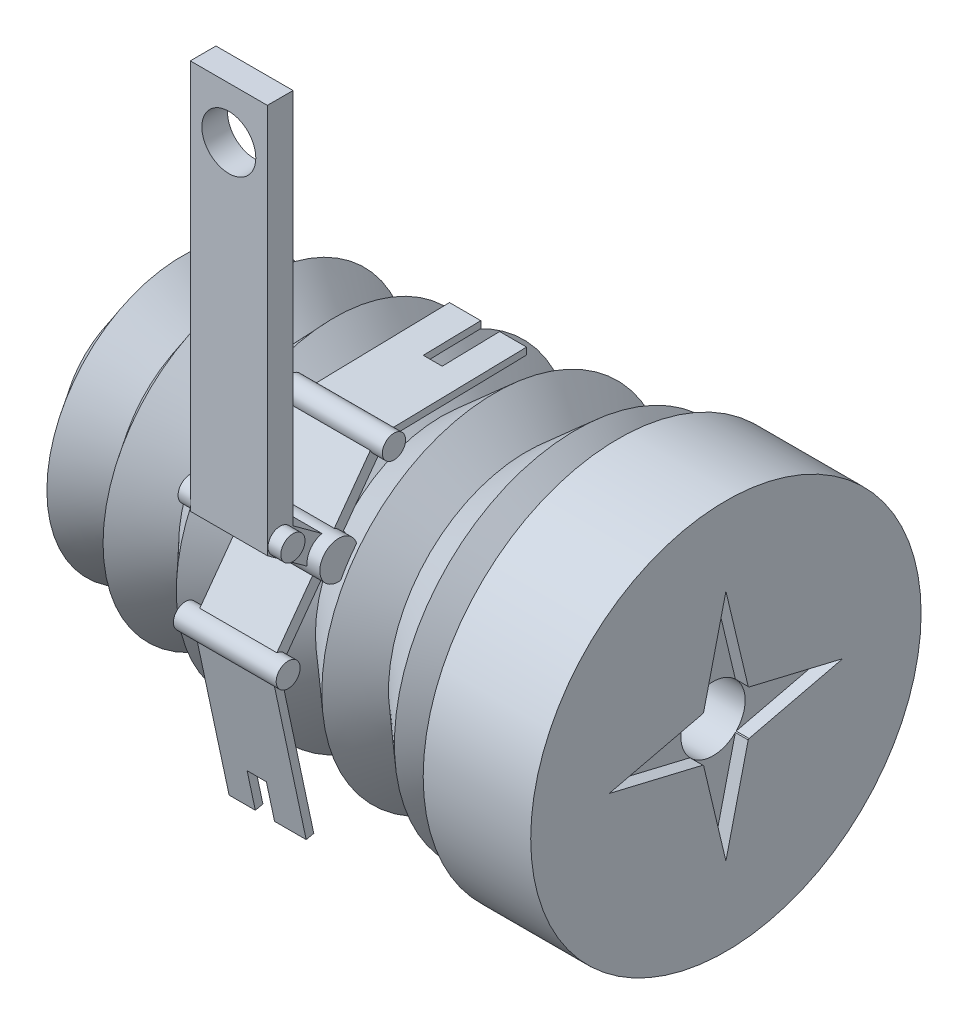
from build123d import *

# Parameters (mm, degrees)
SKIZZE3_R                             = 4.65
SCHNITT_LINEAR_AUSTRAGEN1_DEPTH       = 23
SKIZZE4_R                             = 2.5
SCHNITT_LINEAR_AUSTRAGEN2_DEPTH       = 32.476295332
AUFSATZ_LINEAR_AUSTRAGEN2_DEPTH       = 6
SKIZZE10_R                            = 2.1
SCHNITT_LINEAR_AUSTRAGEN4_DEPTH       = 6
SKIZZE13_W                            = 6
SKIZZE13_H                            = 0.905916259
AUFSATZ_LINEAR_AUSTRAGEN3_DEPTH       = 6
SKIZZE14_W                            = 6
SKIZZE14_H                            = 0.886770142
AUFSATZ_LINEAR_AUSTRAGEN4_DEPTH       = 6
AUFSATZ_LINEAR_AUSTRAGEN5_DEPTH       = 6
AUFSATZ_LINEAR_AUSTRAGEN6_DEPTH       = 6
SCHNITT_LINEAR_AUSTRAGEN5_DEPTH       = 1
KREISMUSTER1_COUNT                    = 4
AUFSATZ_LINEAR_AUSTRAGEN7_DEPTH       = 1
AUFSATZ_LINEAR_AUSTRAGEN7_DEPTH_BACK  = 7
SKIZZE24_R                            = 1.46260877
AUFSATZ_LINEAR_AUSTRAGEN8_DEPTH       = 1
AUFSATZ_LINEAR_AUSTRAGEN8_DEPTH_BACK  = 7
SKIZZE25_R                            = 0.941763398
AUFSATZ_LINEAR_AUSTRAGEN9_DEPTH       = 1
AUFSATZ_LINEAR_AUSTRAGEN9_DEPTH_BACK  = 7
SKIZZE26_R                            = 0.9041841
AUFSATZ_LINEAR_AUSTRAGEN10_DEPTH      = 1
AUFSATZ_LINEAR_AUSTRAGEN10_DEPTH_BACK = 7
SKIZZE27_R                            = 0.932524048
SKIZZE28_W                            = 1.499442475
SKIZZE28_H                            = 3.05198511
SCHNITT_LINEAR_AUSTRAGEN6_DEPTH       = 2
SKIZZE29_W                            = 1.472214026
SKIZZE29_H                            = 4.476539639
SCHNITT_LINEAR_AUSTRAGEN7_DEPTH       = 0.6


with BuildPart() as part:
    # Skizze2 → Rotation5 (revolve)
    with BuildSketch(Plane.XY, mode=Mode.PRIVATE) as rotation5_sk:
        Polygon((0, 0), (0, 6), (3.36648022, 10.528331662), (6.412062892, 8.264165831), (9.130397088, 11.920661045), (12.157026773, 9.06464462), (15.190566342, 12.27940236), (17.374944781, 9.800306185), (20.845408565, 12.858197338), (23.539774185, 9.800306185), (27.723555025, 13.486714461), (30.156102347, 10.725966298), (34.013267201, 14.124587063), (36.476289904, 11.329251761), (37.323543296, 15.194689333), (45.693256891, 15.194689333), (45.693256891, 0), (40, 0), align=None)
    revolve(rotation5_sk.sketch.rotate(Axis((45.693256891, 0, 0), (-1, 0, 0)), 90), axis=Axis((45.693256891, 0, 0), (-1, 0, 0)))

    # Skizze3 → Schnitt-Linear austragen1 (cut)
    with BuildSketch(Plane.ZY):
        Circle(SKIZZE3_R)
    extrude(amount=-SCHNITT_LINEAR_AUSTRAGEN1_DEPTH, mode=Mode.SUBTRACT)

    # Skizze4 → Schnitt-Linear austragen2 (cut, through all)
    with BuildSketch(Plane.ZY.offset(-23)):
        Circle(SKIZZE4_R)
    extrude(amount=-SCHNITT_LINEAR_AUSTRAGEN2_DEPTH, mode=Mode.SUBTRACT)

    # Skizze8 → Aufsatz-Linear austragen2 (add)
    with BuildSketch(Plane.ZY.offset(-20)):
        Polygon((5.135425827, 1.713216567), (16, 9.637964787), (16, 40), (14, 40), (14, 10.654654556), (3.956822965, 3.329043072), align=None)
    extrude(amount=-AUFSATZ_LINEAR_AUSTRAGEN2_DEPTH)

    # Skizze10 → Schnitt-Linear austragen4 (cut)
    with BuildSketch(Plane.XY.offset(16)):
        with Locations((23, 36)):
            Circle(SKIZZE10_R)
    extrude(amount=-SCHNITT_LINEAR_AUSTRAGEN4_DEPTH, mode=Mode.SUBTRACT)

    # Skizze13 → Aufsatz-Linear austragen3 (add)
    with BuildSketch(Plane(origin=(0, -1.326741748, 0.96774104), x_dir=(1, 0, 0), z_dir=(-4.115069899356744e-15, -0.8079132523298957, 0.5893014311112186))):
        with Locations((23, 13.484679747)):
            Rectangle(SKIZZE13_W, SKIZZE13_H)
    extrude(amount=AUFSATZ_LINEAR_AUSTRAGEN3_DEPTH)

    # Skizze14 → Aufsatz-Linear austragen4 (add)
    with BuildSketch(Plane(origin=(0, 0.289084756, -0.210861822), x_dir=(1, 0, 0), z_dir=(4.115069899356744e-15, 0.807913252329896, -0.5893014311112185))):
        with Locations((23, -13.507060971)):
            Rectangle(SKIZZE14_W, SKIZZE14_H)
    extrude(amount=AUFSATZ_LINEAR_AUSTRAGEN4_DEPTH)

    # Skizze16 → Aufsatz-Linear austragen5 (add)
    with BuildSketch(Plane(origin=(26, 0, 0), x_dir=(0, 0, -1), z_dir=(1, 0, 0))):
        Polygon((-15.763951974, 2.039248685), (-12.977538642, -11.010844393), (-12.386566519, -10.884661952), (-15.032050222, 1.505390937), align=None)
    extrude(amount=-AUFSATZ_LINEAR_AUSTRAGEN5_DEPTH)

    # Skizze17 → Aufsatz-Linear austragen6 (add)
    with BuildSketch(Plane(origin=(26, 0, 0), x_dir=(0, 0, -1), z_dir=(1, 0, 0))):
        Polygon((-6.807646475, 12.835007174), (4.174727727, 13.079302841), (4.174727727, 13.617814342), (-7.524079824, 13.357582087), align=None)
    extrude(amount=-AUFSATZ_LINEAR_AUSTRAGEN6_DEPTH)

    # Skizze19 → Schnitt-Linear austragen5 (cut)
    with BuildSketch(Plane(origin=(45.693256891, 0, 0), x_dir=(0, 0, -1), z_dir=(1, 0, 0))):
        Polygon((-1.799469686, 1.735485191), (-9.091569519, 0), (-1.799469686, -1.735485191), (-2.158394422, -1.261480685), (-2.415859445, -0.6431354), (-2.5, 0), (-2.408587239, 0.669856338), (-2.158394422, 1.261480685), align=None)
    schnitt_linear_austragen5 = extrude(amount=-SCHNITT_LINEAR_AUSTRAGEN5_DEPTH, mode=Mode.SUBTRACT)

    # Kreismuster1: Schnitt-Linear austragen5 ×4 about axis
    kreismuster1_axis = Axis((0, 0, 0), (1, 0, 0))
    for i in range(1, KREISMUSTER1_COUNT):
        add(schnitt_linear_austragen5.rotate(kreismuster1_axis, i * 360 / KREISMUSTER1_COUNT), mode=Mode.SUBTRACT)

    # Skizze24 → Aufsatz-Linear austragen7 (add, two sides: drawn at the far end of the back side and taken through both)
    with BuildSketch(Plane.ZY.offset(-20).offset(-AUFSATZ_LINEAR_AUSTRAGEN7_DEPTH_BACK)):
        with Locations(Location((11.453507252, 7.575434524, 0), (0, 0, 163.086563891))):
            Circle(SKIZZE24_R)
    extrude(amount=AUFSATZ_LINEAR_AUSTRAGEN7_DEPTH + AUFSATZ_LINEAR_AUSTRAGEN7_DEPTH_BACK)

    # Skizze25 → Aufsatz-Linear austragen8 (add, two sides: drawn at the far end of the back side and taken through both)
    with BuildSketch(Plane.ZY.offset(-20).offset(-AUFSATZ_LINEAR_AUSTRAGEN8_DEPTH_BACK)):
        with Locations((15.010107877, 10.189967275)):
            Circle(SKIZZE25_R)
    extrude(amount=AUFSATZ_LINEAR_AUSTRAGEN8_DEPTH + AUFSATZ_LINEAR_AUSTRAGEN8_DEPTH_BACK)

    # Skizze26 → Aufsatz-Linear austragen9 (add, two sides: drawn at the far end of the back side and taken through both)
    with BuildSketch(Plane(origin=(26, 0, 0), x_dir=(0, 0, -1), z_dir=(1, 0, 0)).offset(-AUFSATZ_LINEAR_AUSTRAGEN9_DEPTH_BACK)):
        with Locations((-7.144644053, 13.070033864)):
            Circle(SKIZZE26_R)
    extrude(amount=AUFSATZ_LINEAR_AUSTRAGEN9_DEPTH + AUFSATZ_LINEAR_AUSTRAGEN9_DEPTH_BACK)

    # Skizze27 → Aufsatz-Linear austragen10 (add, two sides: drawn at the far end of the back side and taken through both)
    with BuildSketch(Plane.ZY.offset(-20).offset(-AUFSATZ_LINEAR_AUSTRAGEN10_DEPTH_BACK)):
        with Locations((15.381369531, 1.80386132)):
            Circle(SKIZZE27_R)
    extrude(amount=AUFSATZ_LINEAR_AUSTRAGEN10_DEPTH + AUFSATZ_LINEAR_AUSTRAGEN10_DEPTH_BACK)

    # Skizze28 → Schnitt-Linear austragen6 (cut)
    with BuildSketch(Plane(origin=(0, -3.130195775, 14.660189045), x_dir=(1, 0, 0), z_dir=(-6.370898410720916e-15, -0.20881002467257814, 0.9779562227401783))):
        with Locations((22.790052948, -6.532291073)):
            Rectangle(SKIZZE28_W, SKIZZE28_H)
    extrude(amount=-SCHNITT_LINEAR_AUSTRAGEN6_DEPTH, mode=Mode.SUBTRACT)

    # Skizze29 → Schnitt-Linear austragen7 (cut)
    with BuildSketch(Plane(origin=(0, 13.518261299, 0.300704803), x_dir=(1, 0, 0), z_dir=(0, 0.9997526864415556, 0.022238838838681812))):
        with Locations((23.172580504, 2.23826982)):
            Rectangle(SKIZZE29_W, SKIZZE29_H)
    extrude(amount=-SCHNITT_LINEAR_AUSTRAGEN7_DEPTH, mode=Mode.SUBTRACT)


solid = part.part
